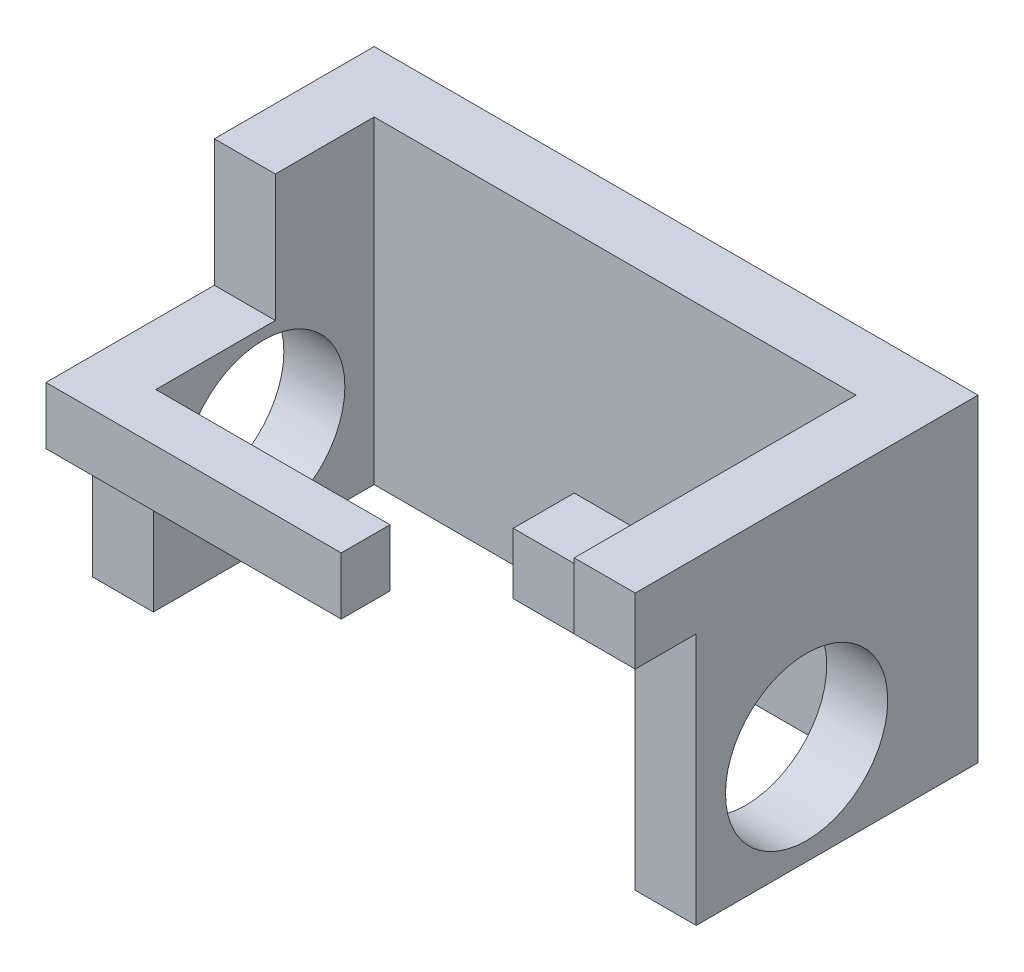
from build123d import *

# Parameters (mm, degrees)
CROQUIS2_W              = 49.5
CROQUIS2_H              = 26.9
SALIENTE_EXTRUIR1_DEPTH = 26.1
CORTAR_EXTRUIR2_DEPTH   = 26.1
CORTAR_EXTRUIR4_REACH   = 60.181
CROQUIS9_R              = 6.65
CORTAR_EXTRUIR5_REACH   = 64.089
CROQUIS8_R              = 6.65
CORTAR_EXTRUIR6_DEPTH   = 10.4
CROQUIS10_W             = 24.2
CROQUIS10_H             = 11
CORTAR_EXTRUIR7_DEPTH   = 3.8
CROQUIS13_W             = 19.2
CROQUIS13_H             = 11
CORTAR_EXTRUIR8_DEPTH   = 0.2
CORTAR_EXTRUIR9_REACH   = 64.089
CROQUIS14_W             = 3.8
CROQUIS14_H             = 20.7
CROQUIS15_W             = 10
CROQUIS15_H             = 5
SALIENTE_EXTRUIR2_DEPTH = 5
CROQUIS16_W             = 5
CROQUIS16_H             = 5.4
SALIENTE_EXTRUIR3_DEPTH = 1.2


with BuildPart() as part:
    # Croquis2 → Saliente-Extruir1 (new body)
    with BuildSketch(Plane(origin=(0, 0, 0), x_dir=(1, 0, 0), z_dir=(0, 1, 0))):
        with Locations((-24.75, -13.45)):
            Rectangle(CROQUIS2_W, CROQUIS2_H)
    extrude(amount=SALIENTE_EXTRUIR1_DEPTH)

    # Croquis6 → Cortar-Extruir2 (cut)
    with BuildSketch(Plane(origin=(0, 26.1, 0), x_dir=(1, 0, 0), z_dir=(0, 1, 0))):
        Polygon((-44.5, -21.9), (-44.5, -22.9), (-25.3, -22.9), (-25.3, -26.9), (-5, -26.9), (-5, -21.9), (-5, -5), (-44.5, -5), align=None)
    extrude(amount=-CORTAR_EXTRUIR2_DEPTH, mode=Mode.SUBTRACT)

    # Croquis9 → Cortar-Extruir4 (cut, up to next)
    with BuildSketch(Plane(origin=(-44.5, 0, 0), x_dir=(0, 0, -1), z_dir=(1, 0, 0)), mode=Mode.PRIVATE) as cortar_extruir4_sk1:
        with Locations((-14.05, 8.15)):
            Circle(CROQUIS9_R)
    cortar_extruir4_tool1 = extrude(cortar_extruir4_sk1.sketch, amount=-CORTAR_EXTRUIR4_REACH, mode=Mode.PRIVATE) & part.part
    add(cortar_extruir4_tool1.solids().sort_by_distance((-44.5, 8.15, 14.05))[0], mode=Mode.SUBTRACT)

    # Croquis8 → Cortar-Extruir5 (cut, up to next)
    with BuildSketch(Plane(origin=(0, 0, 0), x_dir=(0, 0, -1), z_dir=(1, 0, 0)), mode=Mode.PRIVATE) as cortar_extruir5_sk1:
        with Locations((-14.05, 8.15)):
            Circle(CROQUIS8_R)
    cortar_extruir5_tool1 = extrude(cortar_extruir5_sk1.sketch, amount=-CORTAR_EXTRUIR5_REACH, mode=Mode.PRIVATE) & part.part
    add(cortar_extruir5_tool1.solids().sort_by_distance((0, 8.15, 14.05))[0], mode=Mode.SUBTRACT)

    # Croquis11 → Cortar-Extruir6 (cut)
    with BuildSketch(Plane(origin=(0, 26.1, 0), x_dir=(1, 0, 0), z_dir=(0, 1, 0))):
        Polygon((-44.5, -13.1), (-49.5, -13.1), (-49.5, -26.9), (-25.3, -26.9), (-25.3, -22.9), (-44.5, -22.9), align=None)
    extrude(amount=-CORTAR_EXTRUIR6_DEPTH, mode=Mode.SUBTRACT)

    # Croquis10 → Cortar-Extruir7 (cut)
    with BuildSketch(Plane.XY.offset(26.9)):
        with Locations((-37.4, 5.5)):
            Rectangle(CROQUIS10_W, CROQUIS10_H)
    extrude(amount=-CORTAR_EXTRUIR7_DEPTH, mode=Mode.SUBTRACT)

    # Croquis13 → Cortar-Extruir8 (cut)
    with BuildSketch(Plane(origin=(0, 0, 22.9), x_dir=(-1, 0, 0), z_dir=(0, 0, -1))):
        with Locations((34.9, 5.5)):
            Rectangle(CROQUIS13_W, CROQUIS13_H)
    extrude(amount=-CORTAR_EXTRUIR8_DEPTH, mode=Mode.SUBTRACT)

    # Croquis14 → Cortar-Extruir9 (cut, up to next)
    with BuildSketch(Plane(origin=(0, 0, 0), x_dir=(0, 0, -1), z_dir=(1, 0, 0)), mode=Mode.PRIVATE) as cortar_extruir9_sk1:
        with Locations((-25, 10.35)):
            Rectangle(CROQUIS14_W, CROQUIS14_H)
    cortar_extruir9_tool1 = extrude(cortar_extruir9_sk1.sketch, amount=-CORTAR_EXTRUIR9_REACH, mode=Mode.PRIVATE) & part.part
    add(cortar_extruir9_tool1.solids().sort_by_distance((0, 10.35, 25))[0], mode=Mode.SUBTRACT)

    # Croquis15 → Saliente-Extruir2 (add)
    with BuildSketch(Plane.XY.offset(23.1)):
        with Locations((-10, 18.2)):
            Rectangle(CROQUIS15_W, CROQUIS15_H)
    extrude(amount=-SALIENTE_EXTRUIR2_DEPTH)

    # Croquis16 → Saliente-Extruir3 (add)
    with BuildSketch(Plane.XY.offset(26.9)):
        with Locations((-2.5, 23.4)):
            Rectangle(CROQUIS16_W, CROQUIS16_H)
    extrude(amount=SALIENTE_EXTRUIR3_DEPTH)


solid = part.part
